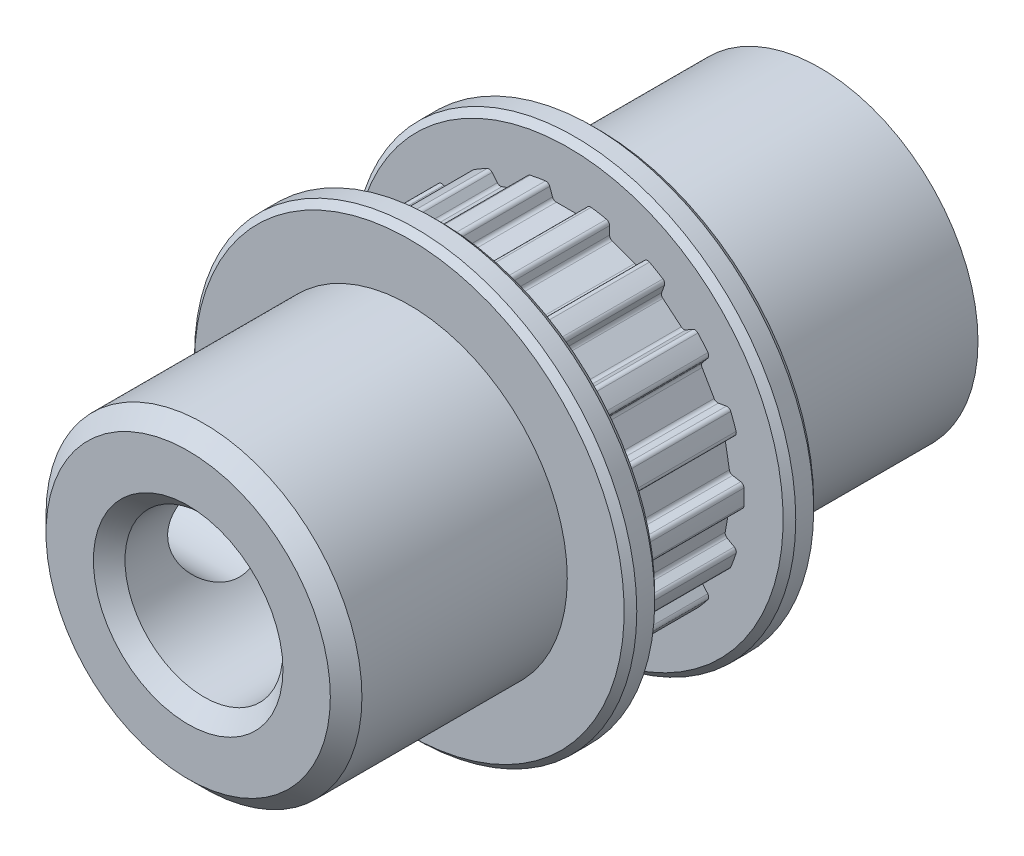
from build123d import *

# Parameters (mm, degrees)
TOOTH_EXTRUDE_START    = -2.032
TOOTH_EXTRUDE_DEPTH    = 4.064
TOOTH_PATTERN_18_COUNT = 18
SKETCH4_R              = 5
EXTRUDE_772_DEPTH      = 7
SKETCH6_R              = 1.65
CUT_EXTRUDE_926_DEPTH  = 5
BOSS_EXTRUDE3_START    = 8
SKETCH8_R              = 5
BOSS_EXTRUDE3_DEPTH    = 8
SKETCH5_R              = 2.5
CUT_EXTRUDE4_DEPTH     = 23
CHAMFER1_SIZE          = 0.5
CHAMFER2_SIZE          = 0.2
CHAMFER3_SIZE          = 1
CHAMFER3_SIZE2         = 1.732050808


with BuildPart() as part:
    # GearBelt-BaseSketch → 0.080in Pitch 'MXL', 0.125in Belt Width, 11,6425mm P.D. (revolve)
    with BuildSketch(Plane(origin=(0, 0, 0), x_dir=(0, 0, -1), z_dir=(1, 0, 0)), mode=Mode.PRIVATE) as f_0_080in_pitch_mxl_0_125in_belt_width_sk:
        Polygon((-3, 0), (3, 0), (3, 7), (2.032, 7), (2.032, 5.567251199), (-2.032, 5.567251199), (-2.032, 7), (-3, 7), align=None)
    revolve(f_0_080in_pitch_mxl_0_125in_belt_width_sk.sketch.rotate(Axis((0, 0, 3.048), (0, 0, -1)), 90), axis=Axis((0, 0, 3.048), (0, 0, -1)))

    # Tooth-Sketch → Tooth-Extrude (cut)
    with BuildSketch(Plane.XY.offset(TOOTH_EXTRUDE_START)):
        with BuildLine():
            Line((-0.379703626, 5.110051208), (0.379703626, 5.110051208))
            ThreePointArc((0.379703626, 5.110051208), (0.452547836, 5.133018899), (0.499044593, 5.193614652))
            Line((0.499044593, 5.193614652), (0.587822803, 5.43753078))
            ThreePointArc((0.587822803, 5.43753078), (0.641250062, 5.502650124), (0.723672162, 5.520016713))
            Line((0.723672162, 5.520016713), (0.723672162, 8.060016713))
            Line((0.723672162, 8.060016713), (-0.723672162, 8.060016713))
            Line((-0.723672162, 8.060016713), (-0.723672162, 5.520016713))
            ThreePointArc((-0.723672162, 5.520016713), (-0.641250062, 5.502650124), (-0.587822803, 5.43753078))
            Line((-0.587822803, 5.43753078), (-0.499044593, 5.193614652))
            ThreePointArc((-0.499044593, 5.193614652), (-0.452547836, 5.133018899), (-0.379703626, 5.110051208))
        make_face()
    tooth_extrude = extrude(amount=TOOTH_EXTRUDE_DEPTH, mode=Mode.SUBTRACT)

    # Tooth Pattern, 18: Tooth-Extrude ×18 about axis
    tooth_pattern_18_axis = Axis((0, 0, 0), (0, 0, 1))
    for i in range(1, TOOTH_PATTERN_18_COUNT):
        add(tooth_extrude.rotate(tooth_pattern_18_axis, i * 360 / TOOTH_PATTERN_18_COUNT), mode=Mode.SUBTRACT)

    # Sketch4 → Extrude 772 (add)
    with BuildSketch(Plane.XY.offset(3)):
        with Locations(Location((0, 0, 0), (0, 0, 180))):
            Circle(SKETCH4_R)
    extrude(amount=EXTRUDE_772_DEPTH)

    # Sketch6 → Cut-Extrude 926 (cut)
    with BuildSketch(Plane.ZY.offset(5)):
        with Locations((6.5, 0)):
            Circle(SKETCH6_R)
    extrude(amount=-CUT_EXTRUDE_926_DEPTH, mode=Mode.SUBTRACT)

    # Sketch8 → Boss-Extrude3 (add)
    with BuildSketch(Plane(origin=(0, 0, -3), x_dir=(-1, 0, 0), z_dir=(0, 0, -1)).offset(BOSS_EXTRUDE3_START)):
        Circle(SKETCH8_R)
    extrude(amount=-BOSS_EXTRUDE3_DEPTH)

    # Sketch5 → Cut-Extrude4 (cut)
    with BuildSketch(Plane.XY.offset(10)):
        Circle(SKETCH5_R)
    extrude(amount=-CUT_EXTRUDE4_DEPTH, mode=Mode.SUBTRACT)

    # Chamfer1
    chamfer1_edges = [part.edges().sort_by_distance(p)[0] for p in [
        (5, 0, 10),
        (-2.5, 0, 10),
    ]]
    chamfer(chamfer1_edges, length=CHAMFER1_SIZE)

    # Chamfer2
    chamfer2_edges = [part.edges().sort_by_distance(p)[0] for p in [
        (-7, 0, -3),
        (-7, 0, -2.032),
        (-7, 0, 2.032),
        (-7, 0, 3),
    ]]
    chamfer(chamfer2_edges, length=CHAMFER2_SIZE)

    # Chamfer3
    chamfer3_edges = [part.edges().sort_by_distance(p)[0] for p in [
        (5, 0, -11),
    ]]
    chamfer3_side = [part.faces().sort_by_distance(p)[0] for p in [
        (5, 0, -7),
    ]]
    chamfer(chamfer3_edges, length=CHAMFER3_SIZE, length2=CHAMFER3_SIZE2, reference=chamfer3_side[0])


solid = part.part
